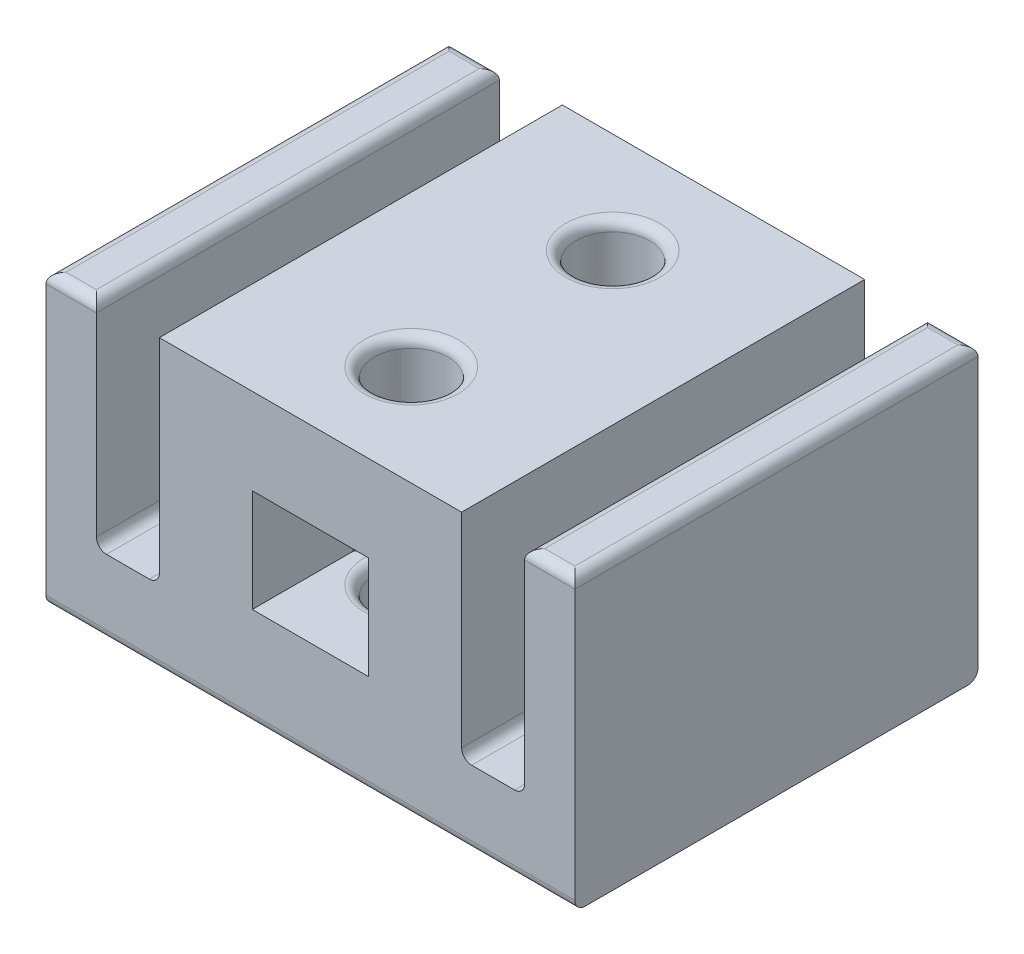
from build123d import *

# Parameters (mm, degrees)
BOSS_EXTRUDE1_DEPTH = 12.7
SKETCH4_R           = 2.3241
CUT_EXTRUDE1_DEPTH  = 19.05
CUT_EXTRUDE2_START  = -6.35
CUT_EXTRUDE2_DEPTH  = 6.477
FILLET1_R           = 0.635


with BuildPart() as part:
    # Sketch2 → Boss-Extrude1 (new, symmetric)
    with BuildSketch(Plane.XY):
        Polygon((-9.525, 18.759139671), (9.525, 18.759139671), (9.525, 5.265389671), (13.49375, 5.265389671), (13.49375, 18.759139671), (16.66875, 18.759139671), (16.66875, 0.502889671), (-16.66875, 0.502889671), (-16.66875, 18.759139671), (-13.49375, 18.759139671), (-13.49375, 5.265389671), (-9.525, 5.265389671), align=None)
    extrude(amount=BOSS_EXTRUDE1_DEPTH, both=True)

    # Sketch4 → Cut-Extrude1 (cut)
    with BuildSketch(Plane.XZ.offset(-0.502889671)):
        with Locations((0, 6.35)):
            Circle(SKETCH4_R)
        with Locations((0, -6.35)):
            Circle(SKETCH4_R)
    extrude(amount=-CUT_EXTRUDE1_DEPTH, mode=Mode.SUBTRACT)

    # Sketch5 → Cut-Extrude2 (cut)
    with BuildSketch(Plane.XZ.offset(-0.502889671).offset(CUT_EXTRUDE2_START)):
        Polygon((-3.666174209, -6.35), (-3.666174209, -14.177432374), (3.666174209, -14.177432374), (3.666174209, -6.35), (1.833087105, -3.175), (-1.833087105, -3.175), align=None)
        Polygon((-3.666174209, 6.35), (-1.833087105, 3.175), (1.833087105, 3.175), (3.666174209, 6.35), (3.666174209, 14.506792856), (-3.666174209, 14.506792856), align=None)
    extrude(amount=-CUT_EXTRUDE2_DEPTH, mode=Mode.SUBTRACT)

    # Fillet1
    fillet1_edges = [part.edges().sort_by_distance(p)[0] for p in [
        (15.08125, 18.759139671, -12.7),
        (0, 0.502889671, -12.7),
        (-15.08125, 18.759139671, -12.7),
        (-15.08125, 18.759139671, 12.7),
        (9.525, 5.265389671, 0),
        (13.49375, 5.265389671, 0),
        (13.49375, 18.759139671, 0),
        (16.66875, 18.759139671, 0),
        (-16.66875, 18.759139671, 0),
        (-13.49375, 18.759139671, 0),
        (-13.49375, 5.265389671, 0),
        (-9.525, 5.265389671, 0),
        (0, 0.502889671, 12.7),
        (15.08125, 18.759139671, 12.7),
        (-2.3241, 18.759139671, 6.35),
        (-2.3241, 0.502889671, 6.35),
        (-2.3241, 18.759139671, -6.35),
        (-2.3241, 0.502889671, -6.35),
        (-2.3241, 6.852889671, 6.35),
        (-2.3241, 13.329889671, 6.35),
        (-2.3241, 6.852889671, -6.35),
        (-2.3241, 13.329889671, -6.35),
    ]]
    fillet(fillet1_edges, radius=FILLET1_R)


solid = part.part
